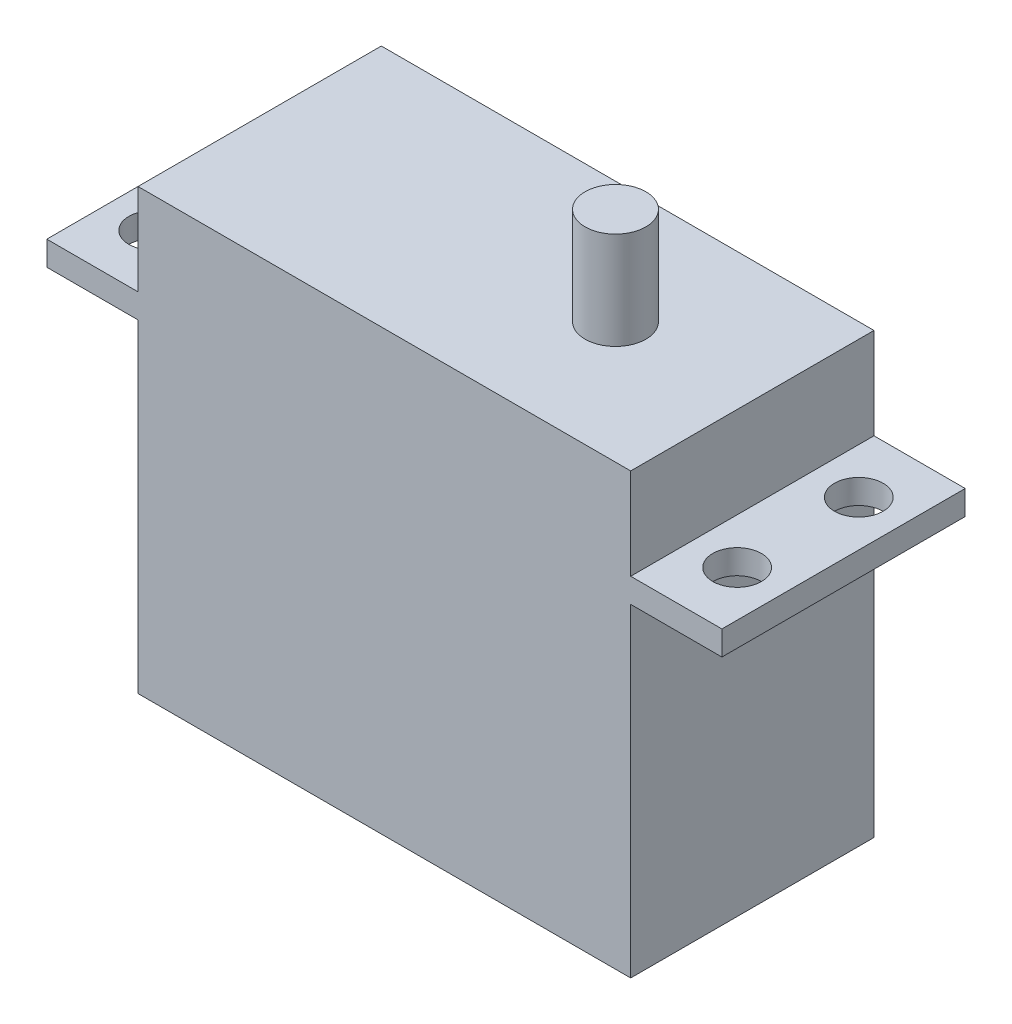
from build123d import *

# Parameters (mm, degrees)
SKETCH1_W                = 40.5
SKETCH1_H                = 20
BOSS_EXTRUDE1_DEPTH      = 36.1
SKETCH2_R                = 2.5
BOSS_EXTRUDE2_DEPTH      = 8
BOSS_EXTRUDE3_DEPTH      = 7.5
BOSS_EXTRUDE3_DEPTH_BACK = 48
SKETCH3_W                = 20
SKETCH3_H                = 2
SKETCH4_R                = 2
CUT_EXTRUDE1_DEPTH       = 7.5


with BuildPart() as part:
    # Sketch1 → Boss-Extrude1 (new body)
    with BuildSketch(Plane(origin=(0, 0, 0), x_dir=(1, 0, 0), z_dir=(0, 1, 0))):
        with Locations((3.506737992, 0.753901676)):
            Rectangle(SKETCH1_W, SKETCH1_H)
    extrude(amount=BOSS_EXTRUDE1_DEPTH)

    # Sketch2 → Boss-Extrude2 (add)
    with BuildSketch(Plane(origin=(0, 36.1, 0), x_dir=(1, 0, 0), z_dir=(0, 1, 0))):
        with Locations(Location((12.506737992, 0.753901676, 0), (0, 0, 270))):
            Circle(SKETCH2_R)
    extrude(amount=BOSS_EXTRUDE2_DEPTH)

    # Sketch3 → Boss-Extrude3 (add, two sides: drawn at the far end of the back side and taken through both)
    with BuildSketch(Plane.ZY.offset(16.743262008).offset(-BOSS_EXTRUDE3_DEPTH_BACK)):
        with Locations((-0.753901676, 27.6)):
            Rectangle(SKETCH3_W, SKETCH3_H)
    extrude(amount=BOSS_EXTRUDE3_DEPTH + BOSS_EXTRUDE3_DEPTH_BACK)

    # Sketch4 → Cut-Extrude1 (cut)
    with BuildSketch(Plane(origin=(0, 28.6, 0), x_dir=(1, 0, 0), z_dir=(0, 1, 0))):
        with Locations(Location((-20.493262008, 5.753901676, 0), (0, 0, 270))):
            Circle(SKETCH4_R)
        with Locations(Location((27.506737992, 5.753901676, 0), (0, 0, 270))):
            Circle(SKETCH4_R)
        with Locations(Location((-20.493262008, -4.246098324, 0), (0, 0, 270))):
            Circle(SKETCH4_R)
        with Locations(Location((27.506737992, -4.246098324, 0), (0, 0, 270))):
            Circle(SKETCH4_R)
    extrude(amount=-CUT_EXTRUDE1_DEPTH, mode=Mode.SUBTRACT)


solid = part.part
